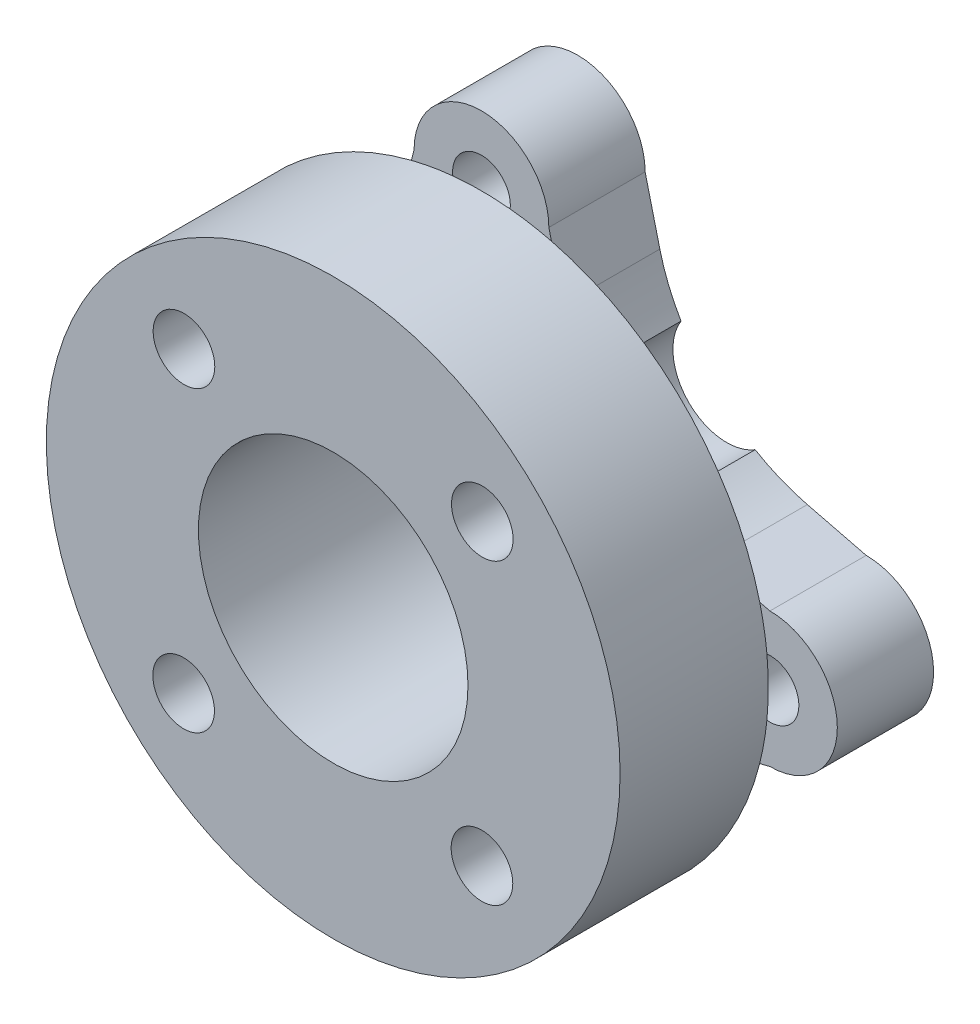
from build123d import *

# Parameters (mm, degrees)
SKETCH1_R           = 1.5
SKETCH1_R_2         = 7.000334442
BOSS_EXTRUDE1_DEPTH = 5
SKETCH2_R           = 14.9
SKETCH2_R_2         = 7.000334442
BOSS_EXTRUDE2_DEPTH = 7.7
SKETCH3_R           = 1.6
CUT_EXTRUDE1_DEPTH  = 30.075574726
SKETCH4_R           = 2.8
CUT_EXTRUDE2_DEPTH  = 5


with BuildPart() as part:
    # Sketch1 → Boss-Extrude1 (new body)
    with BuildSketch(Plane.XY):
        with BuildLine():
            ThreePointArc((-6.973340003, 7.151168067), (-5.280838659, 9.337824918), (-4.251877521, 11.904392268))
            Line((-4.251877521, 11.904392268), (-3.487041473, 14.995112823))
            ThreePointArc((-3.487041473, 14.995112823), (0.012426609, 18.494580904), (3.51189469, 14.995112823))
            Line((3.51189469, 14.995112823), (4.276793265, 11.904512123))
            ThreePointArc((4.276793265, 11.904512123), (5.305826539, 9.337973695), (6.998389341, 7.151364414))
            ThreePointArc((6.998389341, 7.151364414), (7.087863136, 7.062910899), (7.176217024, 6.973338723))
            ThreePointArc((7.176217024, 6.973338723), (9.365889736, 5.275504745), (11.937407084, 4.243707607))
            Line((11.937407084, 4.243707607), (14.995112823, 3.487041473))
            ThreePointArc((14.995112823, 3.487041473), (18.494580904, -0.012426609), (14.995112823, -3.51189469))
            Line((14.995112823, -3.51189469), (11.916521074, -4.273821147))
            ThreePointArc((11.916521074, -4.273821147), (9.351558223, -5.301952454), (7.165910263, -6.992819512))
            ThreePointArc((7.165910263, -6.992819512), (7.073811789, -7.085865183), (6.980503135, -7.177697208))
            ThreePointArc((6.980503135, -7.177697208), (5.276194005, -9.371016841), (4.24095393, -11.948534758))
            Line((4.24095393, -11.948534758), (3.487041473, -14.995112823))
            ThreePointArc((3.487041473, -14.995112823), (-0.012426609, -18.494580904), (-3.51189469, -14.995112823))
            Line((-3.51189469, -14.995112823), (-4.281948892, -11.883680625))
            ThreePointArc((-4.281948892, -11.883680625), (-5.30570303, -9.326373353), (-6.988342179, -7.145406018))
            ThreePointArc((-6.988342179, -7.145406018), (-7.070989636, -7.063429863), (-7.152677278, -6.980497231))
            ThreePointArc((-7.152677278, -6.980497231), (-9.342997098, -5.281516445), (-11.915577996, -4.249109478))
            Line((-11.915577996, -4.249109478), (-14.995112823, -3.487041473))
            ThreePointArc((-14.995112823, -3.487041473), (-18.494580904, 0.012426609), (-14.995112823, 3.51189469))
            Line((-14.995112823, 3.51189469), (-11.871695344, 4.284915151))
            ThreePointArc((-11.871695344, 4.284915151), (-9.312807198, 5.30957244), (-7.130872005, 6.993909079))
            ThreePointArc((-7.130872005, 6.993909079), (-7.052543558, 7.072976887), (-6.973340003, 7.151168067))
        make_face()
        with Locations((-14.995112823, 0.012426609)):
            Circle(SKETCH1_R, mode=Mode.SUBTRACT)
        with Locations((-0.012426609, -14.995112823)):
            Circle(SKETCH1_R, mode=Mode.SUBTRACT)
        with Locations((14.995112823, -0.012426609)):
            Circle(SKETCH1_R, mode=Mode.SUBTRACT)
        with Locations((0.012426609, 14.995112823)):
            Circle(SKETCH1_R, mode=Mode.SUBTRACT)
        with Locations((0.01262523, -0.004457602)):
            Circle(SKETCH1_R_2, mode=Mode.SUBTRACT)
    extrude(amount=BOSS_EXTRUDE1_DEPTH)

    # Sketch2 → Boss-Extrude2 (add)
    with BuildSketch(Plane.XY.offset(5)):
        with Locations(Location((0.01262523, -0.004457602, 0), (0, 0, 185.670375878))):
            Circle(SKETCH2_R)
        with Locations((0.01262523, -0.004457602)):
            Circle(SKETCH2_R_2, mode=Mode.SUBTRACT)
    extrude(amount=BOSS_EXTRUDE2_DEPTH)

    # Sketch3 → Cut-Extrude1 (cut, through all)
    with BuildSketch(Plane.XY.offset(12.7)):
        with Locations((7.755444484, 7.738361652)):
            Circle(SKETCH3_R)
        with Locations((7.738361652, -7.755444484)):
            Circle(SKETCH3_R)
        with Locations((-7.755444484, -7.738361652)):
            Circle(SKETCH3_R)
        with Locations((-7.738361652, 7.755444484)):
            Circle(SKETCH3_R)
    extrude(amount=-CUT_EXTRUDE1_DEPTH, mode=Mode.SUBTRACT)

    # Sketch4 → Cut-Extrude2 (cut)
    with BuildSketch(Plane(origin=(0, 0, 0), x_dir=(-1, 0, 0), z_dir=(0, 0, -1))):
        with Locations((-7.755444484, 7.738361652)):
            Circle(SKETCH4_R)
        with Locations((7.738361652, 7.755444484)):
            Circle(SKETCH4_R)
        with Locations((7.755444484, -7.738361652)):
            Circle(SKETCH4_R)
        with Locations((-7.738361652, -7.755444484)):
            Circle(SKETCH4_R)
    extrude(amount=-CUT_EXTRUDE2_DEPTH, mode=Mode.SUBTRACT)


solid = part.part
